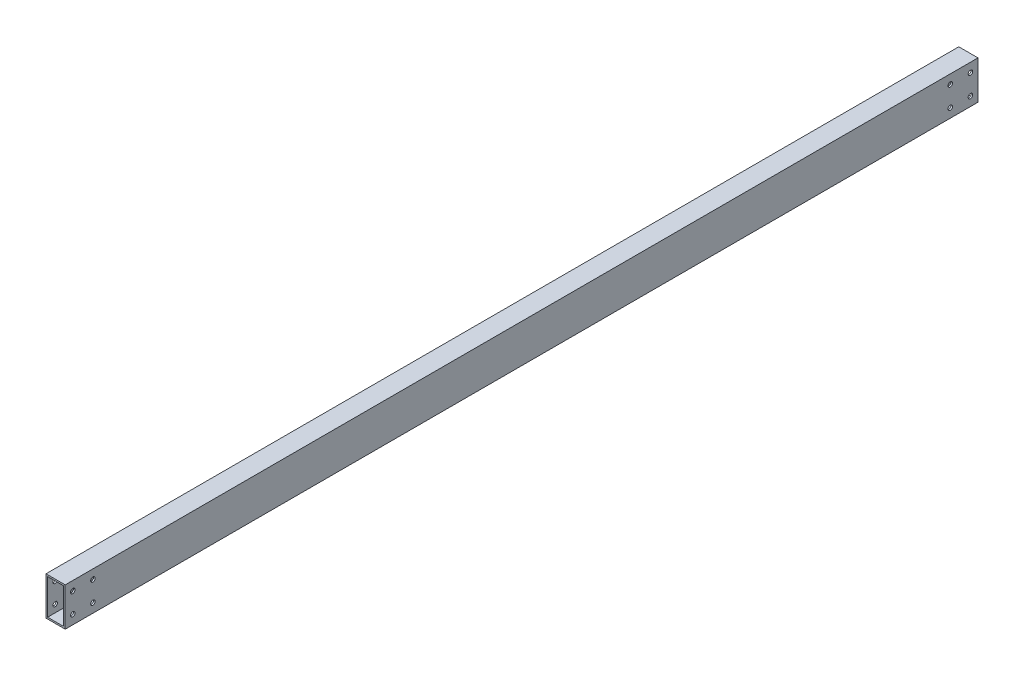
from build123d import *

# Parameters (mm, degrees)
SKETCH1_W                = 38.1
SKETCH1_H                = 76.2
SKETCH1_W_2              = 31.75
SKETCH1_H_2              = 69.85
EXTRUDE_THIN1_DEPTH      = 905
M8_CLEARANCE_HOLE2_D     = 9
M8_CLEARANCE_HOLE2_DEPTH = 3.175
M8_CLEARANCE_HOLE1_D     = 9


with BuildPart() as part:
    # Sketch1 → Extrude-Thin1 (new, symmetric)
    with BuildSketch(Plane.XY):
        Rectangle(SKETCH1_W, SKETCH1_H)
        Rectangle(SKETCH1_W_2, SKETCH1_H_2, mode=Mode.SUBTRACT)
    extrude(amount=EXTRUDE_THIN1_DEPTH, both=True)

    # M8 Clearance Hole2
    with Locations(Plane(origin=(19.05, 0, 0), x_dir=(0, 0, -1), z_dir=(1, 0, 0))):
        with Locations((-890, 20), (-850, -20), (-890, -20), (-850, 20)):
            m8_clearance_hole2 = Hole(M8_CLEARANCE_HOLE2_D / 2, depth=M8_CLEARANCE_HOLE2_DEPTH)

    # M8 Clearance Hole1 (through all)
    with Locations(Plane(origin=(-15.875, 0, 0), x_dir=(0, 0, -1), z_dir=(1, 0, 0))):
        with Locations((-890, 20), (-850, 20), (-850, -20), (-890, -20)):
            m8_clearance_hole1 = Hole(M8_CLEARANCE_HOLE1_D / 2)

    # Mirror1: M8 Clearance Hole2, M8 Clearance Hole1 across plane
    add(m8_clearance_hole2.mirror(Plane.XY), mode=Mode.SUBTRACT)
    add(m8_clearance_hole1.mirror(Plane.XY), mode=Mode.SUBTRACT)


solid = part.part
